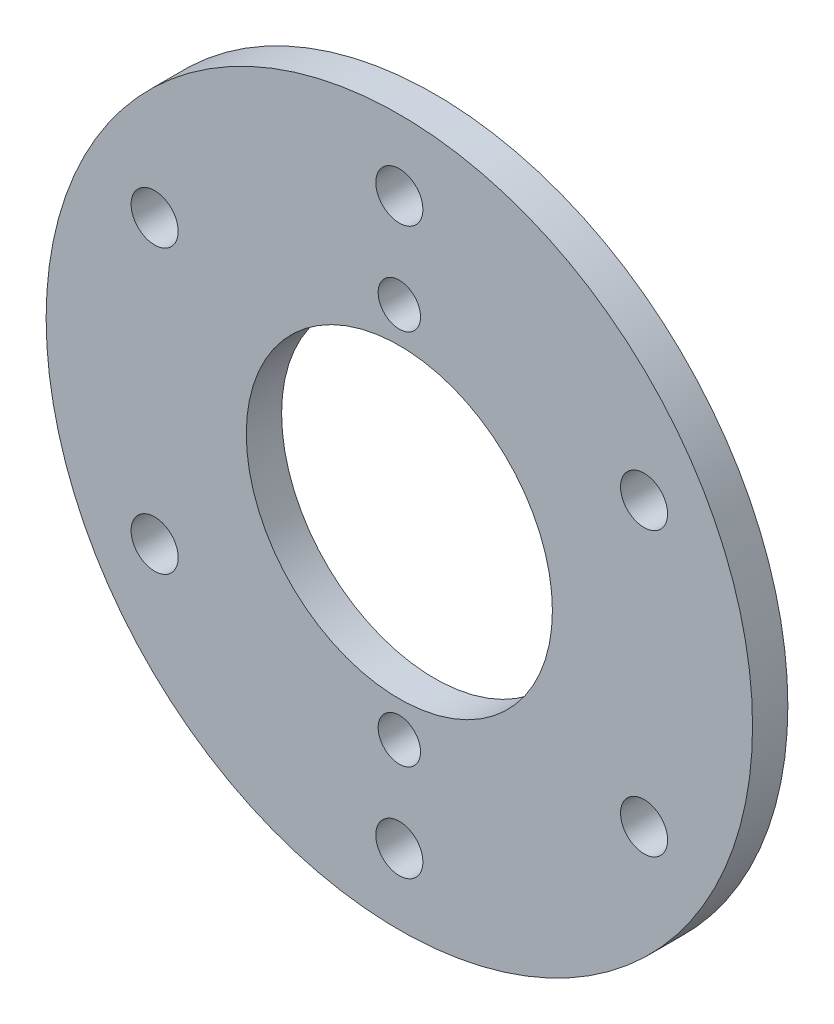
from build123d import *

# Parameters (mm, degrees)
SKETCH1_R           = 150
SKETCH1_R_2         = 65
SKETCH1_R_3         = 9
SKETCH1_R_4         = 10
BOSS_EXTRUDE1_DEPTH = 7.5


with BuildPart() as part:
    # Sketch1 → Boss-Extrude1 (new, symmetric)
    with BuildSketch(Plane.XY):
        Circle(SKETCH1_R)
        Circle(SKETCH1_R_2, mode=Mode.SUBTRACT)
        with Locations((0, 80)):
            Circle(SKETCH1_R_3, mode=Mode.SUBTRACT)
        with Locations((0, 120)):
            Circle(SKETCH1_R_4, mode=Mode.SUBTRACT)
        with Locations((103.923048454, 60)):
            Circle(SKETCH1_R_4, mode=Mode.SUBTRACT)
        with Locations((103.923048454, -60)):
            Circle(SKETCH1_R_4, mode=Mode.SUBTRACT)
        with Locations((0, -120)):
            Circle(SKETCH1_R_4, mode=Mode.SUBTRACT)
        with Locations((-103.923048454, -60)):
            Circle(SKETCH1_R_4, mode=Mode.SUBTRACT)
        with Locations((-103.923048454, 60)):
            Circle(SKETCH1_R_4, mode=Mode.SUBTRACT)
        with Locations((0, -80)):
            Circle(SKETCH1_R_3, mode=Mode.SUBTRACT)
    extrude(amount=BOSS_EXTRUDE1_DEPTH, both=True)


solid = part.part
